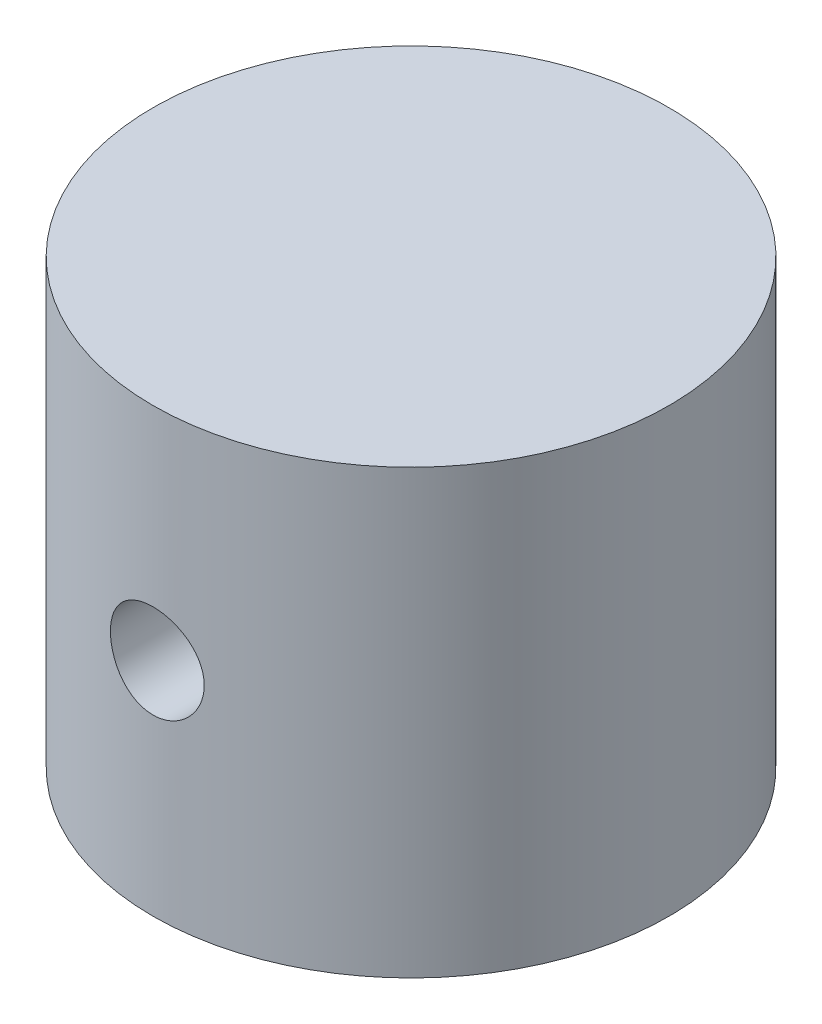
from build123d import *

# Parameters (mm, degrees)
SKETCH1_R                  = 11.1125
BOSS_EXTRUDE1_DEPTH        = 19.05
F_10_32_TAPPED_HOLE1_D     = 4.0386
F_10_32_TAPPED_HOLE1_DEPTH = 11.176
F_10_32_TAPPED_HOLE1_TIP   = 1.213317848


with BuildPart() as part:
    # Sketch1 → Boss-Extrude1 (new body)
    with BuildSketch(Plane(origin=(0, 0, 0), x_dir=(1, 0, 0), z_dir=(0, 1, 0))):
        with Locations(Location((0, 0, 0), (0, 0, 90))):
            Circle(SKETCH1_R)
    extrude(amount=BOSS_EXTRUDE1_DEPTH)

    # #10-32 Tapped Hole1
    with Locations(Plane(origin=(0, 9.525, 11.1125), x_dir=(0, 1, 0), z_dir=(0, 0, 1))):
        with Locations((0, 0)):
            Hole(F_10_32_TAPPED_HOLE1_D / 2, depth=F_10_32_TAPPED_HOLE1_DEPTH)
            with Locations((0, 0, -(F_10_32_TAPPED_HOLE1_DEPTH + F_10_32_TAPPED_HOLE1_TIP / 2))):  # 118° drill point
                Cone(0, F_10_32_TAPPED_HOLE1_D / 2, F_10_32_TAPPED_HOLE1_TIP, mode=Mode.SUBTRACT)


solid = part.part
